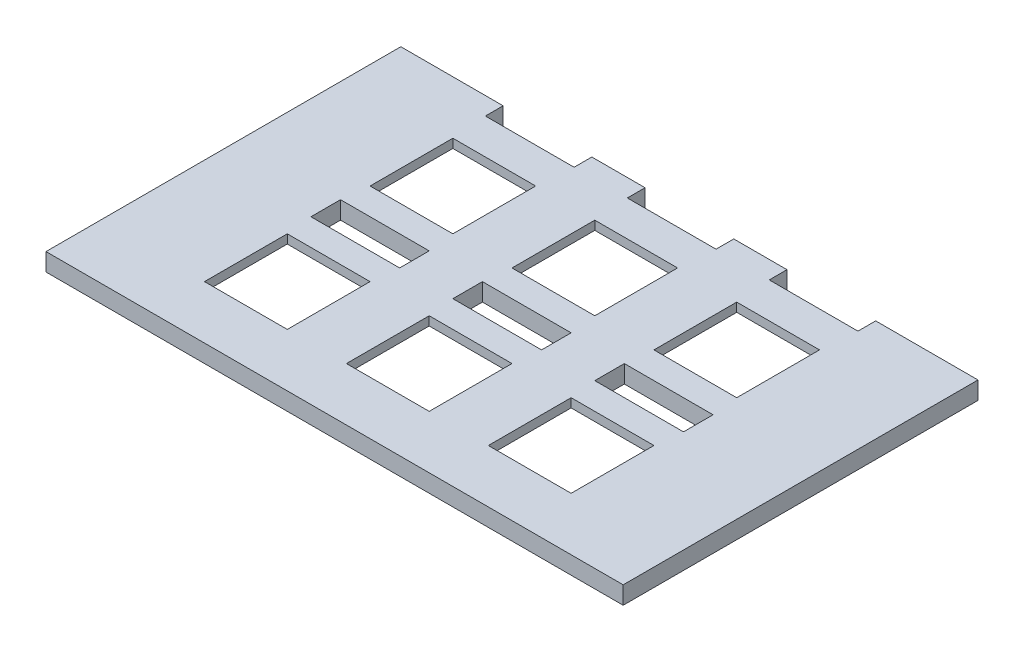
from build123d import *

# Parameters (mm, degrees)
SKETCH1_W               = 87.6
SKETCH1_H               = 60
BOSS_EXTRUDE1_DEPTH     = 3
SKETCH2_W               = 55.4
SKETCH2_H               = 3
BOSS_EXTRUDE2_DEPTH     = 5
SKETCH3_W               = 14
SKETCH3_H               = 14
CUT_EXTRUDE4_DEPTH      = 111.380070665
SKETCH7_W               = 20
SKETCH7_H               = 20
CUT_EXTRUDE5_DEPTH      = 1.5
SKETCH9_W               = 15
SKETCH9_H               = 3
CUT_EXTRUDE6_DEPTH      = 3
SKETCH10_W              = 14
SKETCH10_H              = 14
CUT_EXTRUDE7_DEPTH      = 10
SKETCH11_W              = 20
SKETCH11_H              = 20
CUT_EXTRUDE8_DEPTH      = 1.5
SKETCH12_W              = 15
SKETCH12_H              = 3
CUT_EXTRUDE9_DEPTH      = 40
MIRROR8_COPY_1_SKETCH_W = 14
MIRROR8_COPY_1_SKETCH_H = 14
MIRROR8_COPY_1_DEPTH    = 111.380070665
MIRROR8_COPY_2_SKETCH_W = 20
MIRROR8_COPY_2_SKETCH_H = 20
MIRROR8_COPY_2_DEPTH    = 1.5
SKETCH13_W              = 5
SKETCH13_H              = 2.3
BOSS_EXTRUDE3_DEPTH     = 3
SKETCH15_W              = 15
SKETCH15_H              = 5
CUT_EXTRUDE11_DEPTH     = 111.380070665


with BuildPart() as part:
    # Sketch1 → Boss-Extrude1 (new body)
    with BuildSketch(Plane(origin=(0, 0, 0), x_dir=(1, 0, 0), z_dir=(0, 1, 0))):
        with Locations((43.8, 30)):
            Rectangle(SKETCH1_W, SKETCH1_H)
    extrude(amount=BOSS_EXTRUDE1_DEPTH)

    # Sketch2 → Boss-Extrude2 (add)
    with BuildSketch(Plane(origin=(87.6, 0, 0), x_dir=(0, 0, -1), z_dir=(1, 0, 0))):
        with Locations((30, 1.5)):
            Rectangle(SKETCH2_W, SKETCH2_H)
    boss_extrude2 = extrude(amount=BOSS_EXTRUDE2_DEPTH)

    # Mirror2: Boss-Extrude2 across plane
    add(boss_extrude2.mirror(Plane(origin=(43.8, 0, 0), x_dir=(0, 0, 1), z_dir=(1, 0, 0))))

    # Sketch3 → Cut-Extrude4 (cut, through all)
    with BuildSketch(Plane.XZ):
        with Locations((19.8, -44)):
            Rectangle(SKETCH3_W, SKETCH3_H)
    cut_extrude4 = extrude(amount=-CUT_EXTRUDE4_DEPTH, mode=Mode.SUBTRACT)

    # Sketch7 → Cut-Extrude5 (cut)
    with BuildSketch(Plane.XZ):
        with Locations((19.8, -44)):
            Rectangle(SKETCH7_W, SKETCH7_H)
    cut_extrude5 = extrude(amount=-CUT_EXTRUDE5_DEPTH, mode=Mode.SUBTRACT)

    # Mirror4: Cut-Extrude4, Cut-Extrude5 across plane
    add(cut_extrude4.mirror(Plane(origin=(43.8, 0, 0), x_dir=(0, 0, 1), z_dir=(1, 0, 0))), mode=Mode.SUBTRACT)
    add(cut_extrude5.mirror(Plane(origin=(43.8, 0, 0), x_dir=(0, 0, 1), z_dir=(1, 0, 0))), mode=Mode.SUBTRACT)

    # Sketch9 → Cut-Extrude6 (cut)
    with BuildSketch(Plane(origin=(0, 0, -60), x_dir=(-1, 0, 0), z_dir=(0, 0, -1))):
        with Locations((-19.8, 1.5)):
            Rectangle(SKETCH9_W, SKETCH9_H)
    cut_extrude6 = extrude(amount=-CUT_EXTRUDE6_DEPTH, mode=Mode.SUBTRACT)

    # Mirror6: Cut-Extrude6 across plane
    add(cut_extrude6.mirror(Plane(origin=(43.8, 0, 0), x_dir=(0, 0, 1), z_dir=(1, 0, 0))), mode=Mode.SUBTRACT)

    # Sketch10 → Cut-Extrude7 (cut)
    with BuildSketch(Plane(origin=(0, 3, 0), x_dir=(1, 0, 0), z_dir=(0, 1, 0))):
        with Locations((43.8, 44)):
            Rectangle(SKETCH10_W, SKETCH10_H)
    cut_extrude7 = extrude(amount=-CUT_EXTRUDE7_DEPTH, mode=Mode.SUBTRACT)

    # Sketch11 → Cut-Extrude8 (cut)
    with BuildSketch(Plane.XZ):
        with Locations((43.8, -44)):
            Rectangle(SKETCH11_W, SKETCH11_H)
    cut_extrude8 = extrude(amount=-CUT_EXTRUDE8_DEPTH, mode=Mode.SUBTRACT)

    # Sketch12 → Cut-Extrude9 (cut)
    with BuildSketch(Plane.XZ):
        with Locations((43.8, -58.5)):
            Rectangle(SKETCH12_W, SKETCH12_H)
    extrude(amount=-CUT_EXTRUDE9_DEPTH, mode=Mode.SUBTRACT)

    # Mirror8: Cut-Extrude4, Cut-Extrude5, Cut-Extrude7, Cut-Extrude8 across plane
    add(cut_extrude4.mirror(Plane.XY.offset(-30)), mode=Mode.SUBTRACT)
    add(cut_extrude5.mirror(Plane.XY.offset(-30)), mode=Mode.SUBTRACT)
    add(cut_extrude7.mirror(Plane.XY.offset(-30)), mode=Mode.SUBTRACT)
    add(cut_extrude8.mirror(Plane.XY.offset(-30)), mode=Mode.SUBTRACT)

    # Mirror8 copy 1 sketch → Mirror8 copy 1 (cut, through all)
    with BuildSketch(Plane(origin=(87.6, 0, -60), x_dir=(-1, 0, 0), z_dir=(0, -1, 0))):
        with Locations((19.8, -44)):
            Rectangle(MIRROR8_COPY_1_SKETCH_W, MIRROR8_COPY_1_SKETCH_H)
    extrude(amount=-MIRROR8_COPY_1_DEPTH, mode=Mode.SUBTRACT)

    # Mirror8 copy 2 sketch → Mirror8 copy 2 (cut)
    with BuildSketch(Plane(origin=(87.6, 0, -60), x_dir=(-1, 0, 0), z_dir=(0, -1, 0))):
        with Locations((19.8, -44)):
            Rectangle(MIRROR8_COPY_2_SKETCH_W, MIRROR8_COPY_2_SKETCH_H)
    extrude(amount=-MIRROR8_COPY_2_DEPTH, mode=Mode.SUBTRACT)

    # Sketch13 → Boss-Extrude3 (add)
    with BuildSketch(Plane(origin=(0, 3, 0), x_dir=(1, 0, 0), z_dir=(0, 1, 0))):
        with Locations((-2.5, 58.85)):
            Rectangle(SKETCH13_W, SKETCH13_H)
        with Locations((-2.5, 1.15)):
            Rectangle(SKETCH13_W, SKETCH13_H)
        with Locations((90.1, 1.15)):
            Rectangle(SKETCH13_W, SKETCH13_H)
        with Locations((90.1, 58.85)):
            Rectangle(SKETCH13_W, SKETCH13_H)
    extrude(amount=-BOSS_EXTRUDE3_DEPTH)

    # Sketch15 → Cut-Extrude11 (cut, through all)
    with BuildSketch(Plane.XZ):
        with Locations((19.8, -30)):
            Rectangle(SKETCH15_W, SKETCH15_H)
        with Locations((43.8, -30)):
            Rectangle(SKETCH15_W, SKETCH15_H)
        with Locations((67.8, -30)):
            Rectangle(SKETCH15_W, SKETCH15_H)
    extrude(amount=-CUT_EXTRUDE11_DEPTH, mode=Mode.SUBTRACT)


solid = part.part
